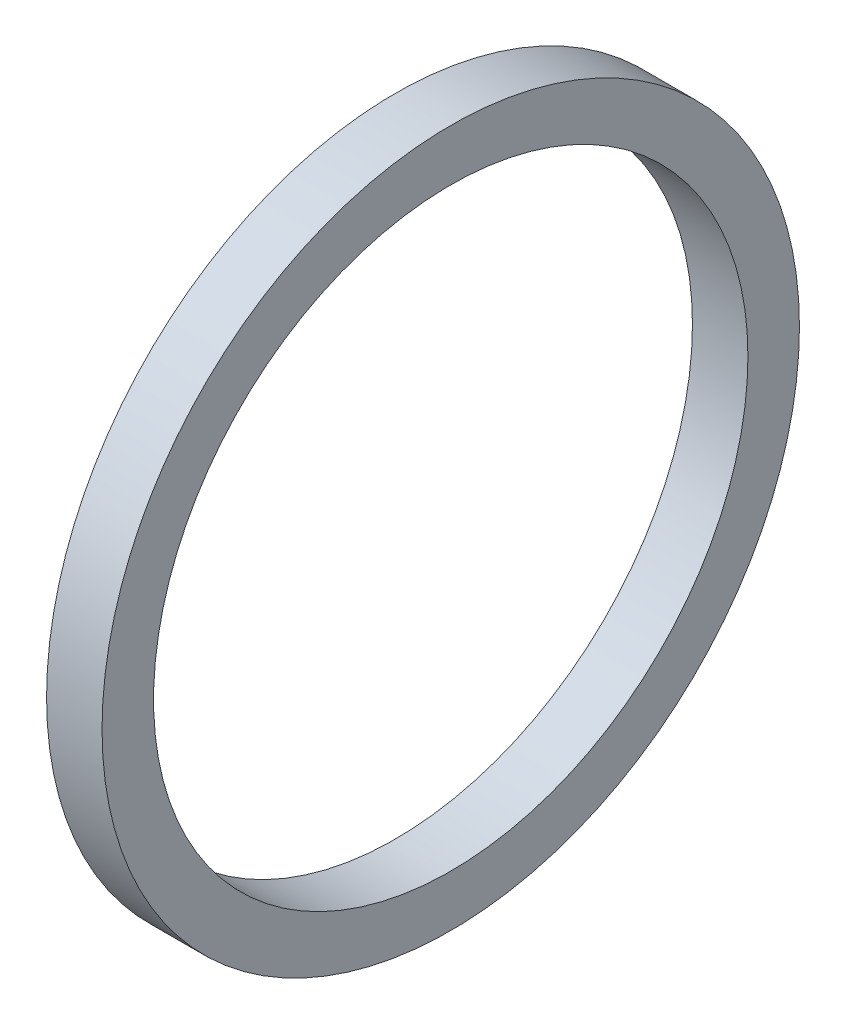
from build123d import *

# Parameters (mm, degrees)
SKETCH1_R           = 44
SKETCH1_R_2         = 37.5
BOSS_EXTRUDE1_DEPTH = 7


with BuildPart() as part:
    # Sketch1 → Boss-Extrude1 (new body)
    with BuildSketch(Plane(origin=(0, 0, 0), x_dir=(0, 0, -1), z_dir=(1, 0, 0))):
        Circle(SKETCH1_R)
        Circle(SKETCH1_R_2, mode=Mode.SUBTRACT)
    extrude(amount=BOSS_EXTRUDE1_DEPTH)


solid = part.part
